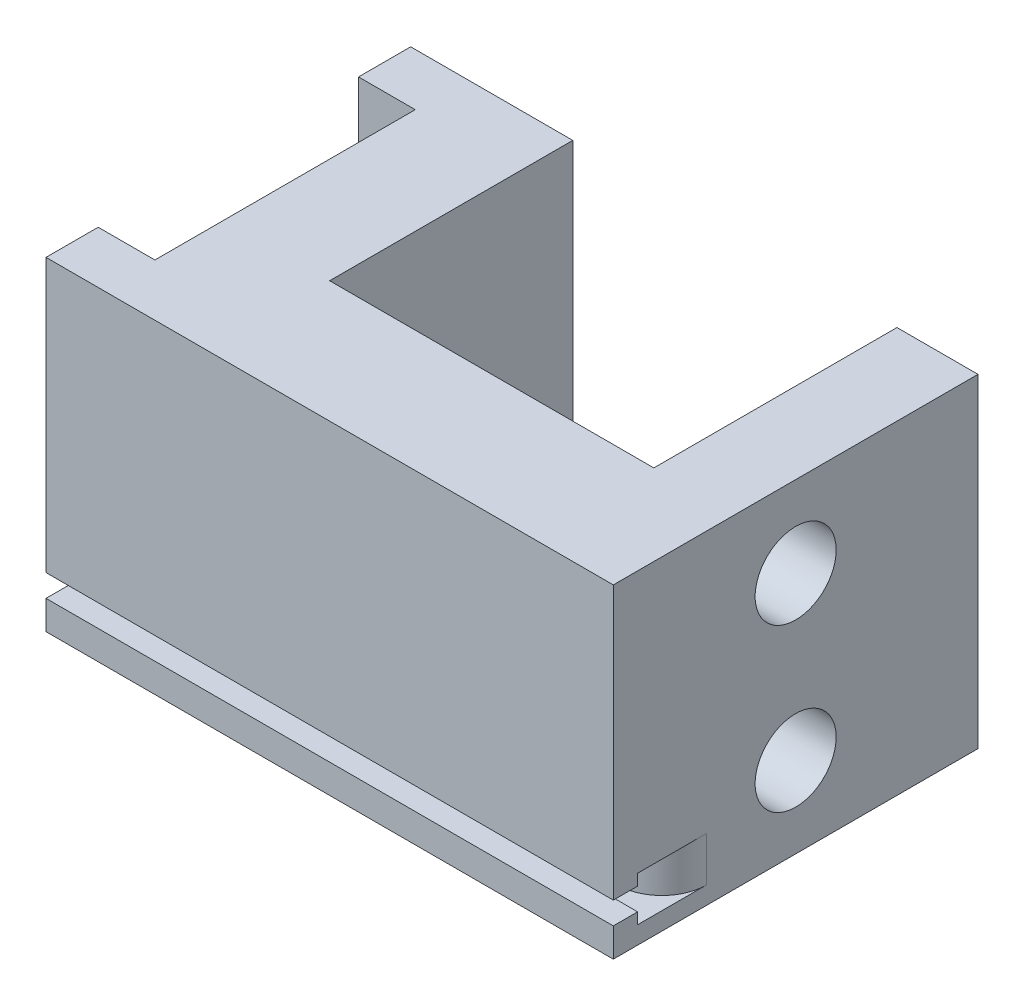
from build123d import *

# Parameters (mm, degrees)
PROFILEBOSS_EXTRUDE1_DEPTH        = 16
MICROSWITCHHOLESKETCH3_W          = 12.85
MICROSWITCHHOLESKETCH3_H          = 12.05
MICROSWITCHHOLECUT_EXTRUDE1_DEPTH = 2.8
MICROSWITCHHOLESKETCH4_R          = 1.5
MICROSWITCHHOLECUT_EXTRUDE2_DEPTH = 3
CLAMPHOLECUT_EXTRUDE4_REACH       = 38.932
CLAMPHOLESSKETCH6_R               = 2
LONGWIRECHANNELCUT_EXTRUDE5_DEPTH = 37.932370625
CUT_EXTRUDE6_DEPTH                = 2.8
FILLET1_R                         = 2.2
FILLET2_R                         = 2.2


with BuildPart() as part:
    # ProfileSketch2 → ProfileBoss-Extrude1 (new body)
    with BuildSketch(Plane(origin=(0, 0, 0), x_dir=(1, 0, 0), z_dir=(0, 1, 0))):
        Polygon((0, 0), (0, -18), (28, -18), (28, 0), (24, 0), (24, -12), (8, -12), (8, 0), align=None)
    extrude(amount=PROFILEBOSS_EXTRUDE1_DEPTH)

    # MicroSwitchHoleSketch3 → MicroSwitchHoleCut-Extrude1 (cut)
    with BuildSketch(Plane.ZY):
        with Locations((9, 9.975)):
            Rectangle(MICROSWITCHHOLESKETCH3_W, MICROSWITCHHOLESKETCH3_H)
    extrude(amount=-MICROSWITCHHOLECUT_EXTRUDE1_DEPTH, mode=Mode.SUBTRACT)

    # MicroSwitchHoleSketch4 → MicroSwitchHoleCut-Extrude2 (cut)
    with BuildSketch(Plane.ZY.offset(-2.8)):
        with Locations((5.825, 10.95)):
            Circle(MICROSWITCHHOLESKETCH4_R)
        with Locations((12.175, 10.95)):
            Circle(MICROSWITCHHOLESKETCH4_R)
    extrude(amount=-MICROSWITCHHOLECUT_EXTRUDE2_DEPTH, mode=Mode.SUBTRACT)

    # ClampHolesSketch6 → ClampHoleCut-Extrude4 (cut, up to next)
    with BuildSketch(Plane(origin=(28, 0, 0), x_dir=(0, 0, -1), z_dir=(1, 0, 0)), mode=Mode.PRIVATE) as clampholecut_extrude4_sk1:
        with Locations((-9, 12)):
            Circle(CLAMPHOLESSKETCH6_R)
    clampholecut_extrude4_tool1 = extrude(clampholecut_extrude4_sk1.sketch, amount=-CLAMPHOLECUT_EXTRUDE4_REACH, mode=Mode.PRIVATE) & part.part
    # ClampHolesSketch6 → ClampHoleCut-Extrude4 (cut, up to next)
    with BuildSketch(Plane(origin=(28, 0, 0), x_dir=(0, 0, -1), z_dir=(1, 0, 0)), mode=Mode.PRIVATE) as clampholecut_extrude4_sk2:
        with Locations((-9, 4)):
            Circle(CLAMPHOLESSKETCH6_R)
    clampholecut_extrude4_tool2 = extrude(clampholecut_extrude4_sk2.sketch, amount=-CLAMPHOLECUT_EXTRUDE4_REACH, mode=Mode.PRIVATE) & part.part
    add(clampholecut_extrude4_tool1.solids().sort_by_distance((28, 12, 9))[0], mode=Mode.SUBTRACT)
    add(clampholecut_extrude4_tool2.solids().sort_by_distance((28, 4, 9))[0], mode=Mode.SUBTRACT)

    # LongWireChannelSketch7 → LongWireChannelCut-Extrude5 (cut, through all)
    with BuildSketch(Plane.ZY):
        Polygon((18, 2.525), (16.8, 2.525), (16.8, 3.075), (15.6, 3.075), (15.6, 0.875), (16.8, 0.875), (16.8, 1.425), (18, 1.425), align=None)
    extrude(amount=-LONGWIRECHANNELCUT_EXTRUDE5_DEPTH, mode=Mode.SUBTRACT)

    # ShortWireChannelSketch8 → Cut-Extrude6 (cut)
    with BuildSketch(Plane.ZY):
        Polygon((7.9, 3.95), (7.9, 0.875), (15.6, 0.875), (15.6, 3.075), (10.1, 3.075), (10.1, 3.95), align=None)
    extrude(amount=-CUT_EXTRUDE6_DEPTH, mode=Mode.SUBTRACT)

    # Fillet1
    fillet1_edges = [part.edges().sort_by_distance(p)[0] for p in [
        (2.8, 1.975, 15.6),
    ]]
    fillet(fillet1_edges, radius=FILLET1_R)

    # Fillet2
    fillet2_edges = [part.edges().sort_by_distance(p)[0] for p in [
        (28, 1.975, 15.6),
    ]]
    fillet(fillet2_edges, radius=FILLET2_R)


solid = part.part
